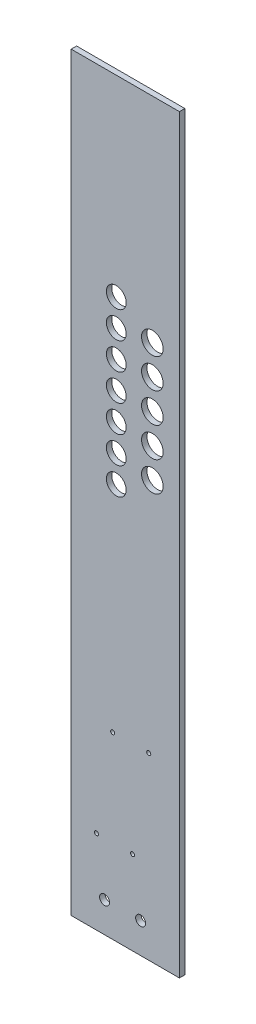
from build123d import *

# Parameters (mm, degrees)
ESQUISSE1_W           = 120
ESQUISSE1_H           = 832
BOSS_EXTRU_1_DEPTH    = 6
M10_CLEARANCE_HOLE1_D = 11
M4_CLEARANCE_HOLE1_D  = 4.5
SKETCH5_R             = 3
CUT_EXTRUDE1_DEPTH    = 10
M20_CLEARANCE_HOLE1_D = 22
M22_CLEARANCE_HOLE1_D = 24
LPATTERN1_COUNT       = 4
LPATTERN1_PITCH       = 30
LPATTERN2_COUNT       = 3
LPATTERN2_PITCH       = 33
LPATTERN3_COUNT       = 3
LPATTERN3_PITCH       = 33
LPATTERN4_COUNT       = 4
LPATTERN4_PITCH       = 30


with BuildPart() as part:
    # Esquisse1 → Boss.-Extru.1 (new body)
    with BuildSketch(Plane.XY):
        Rectangle(ESQUISSE1_W, ESQUISSE1_H)
    extrude(amount=BOSS_EXTRU_1_DEPTH)

    # M10 Clearance Hole1 (through all)
    with Locations(Plane.XY.offset(6)):
        with Locations((17, -382.348938989), (-23, -382.348938989)):
            Hole(M10_CLEARANCE_HOLE1_D / 2)

    # M4 Clearance Hole1 (through all)
    with Locations(Plane.XY.offset(6)):
        with Locations((26, -217), (8, -323), (-32, -323), (-14, -217)):
            Hole(M4_CLEARANCE_HOLE1_D / 2)

    # Sketch5 → Cut-Extrude1 (cut)
    with BuildSketch(Plane.XY.offset(6)):
        with Locations((30, 113)):
            Circle(SKETCH5_R)
        with Locations((-10, 113)):
            Circle(SKETCH5_R)
    extrude(amount=-CUT_EXTRUDE1_DEPTH, mode=Mode.SUBTRACT)

    # M20 Clearance Hole1 (through all)
    with Locations(Plane.XY.offset(6)):
        with Locations((-10, 113)):
            m20_clearance_hole1 = Hole(M20_CLEARANCE_HOLE1_D / 2)

    # M22 Clearance Hole1 (through all)
    with Locations(Plane.XY.offset(6)):
        with Locations((30, 113)):
            m22_clearance_hole1 = Hole(M22_CLEARANCE_HOLE1_D / 2)

    # LPattern1: M20 Clearance Hole1 ×4
    with Locations(*[(0, i * LPATTERN1_PITCH, 0) for i in range(1, LPATTERN1_COUNT)]):
        add(m20_clearance_hole1, mode=Mode.SUBTRACT)

    # LPattern2: M22 Clearance Hole1 ×3
    with Locations(*[(0, i * LPATTERN2_PITCH, 0) for i in range(1, LPATTERN2_COUNT)]):
        add(m22_clearance_hole1, mode=Mode.SUBTRACT)

    # LPattern3: M22 Clearance Hole1 ×3
    with Locations(*[(0, -i * LPATTERN3_PITCH, 0) for i in range(1, LPATTERN3_COUNT)]):
        add(m22_clearance_hole1, mode=Mode.SUBTRACT)

    # LPattern4: M20 Clearance Hole1 ×4
    with Locations(*[(0, -i * LPATTERN4_PITCH, 0) for i in range(1, LPATTERN4_COUNT)]):
        add(m20_clearance_hole1, mode=Mode.SUBTRACT)


solid = part.part
